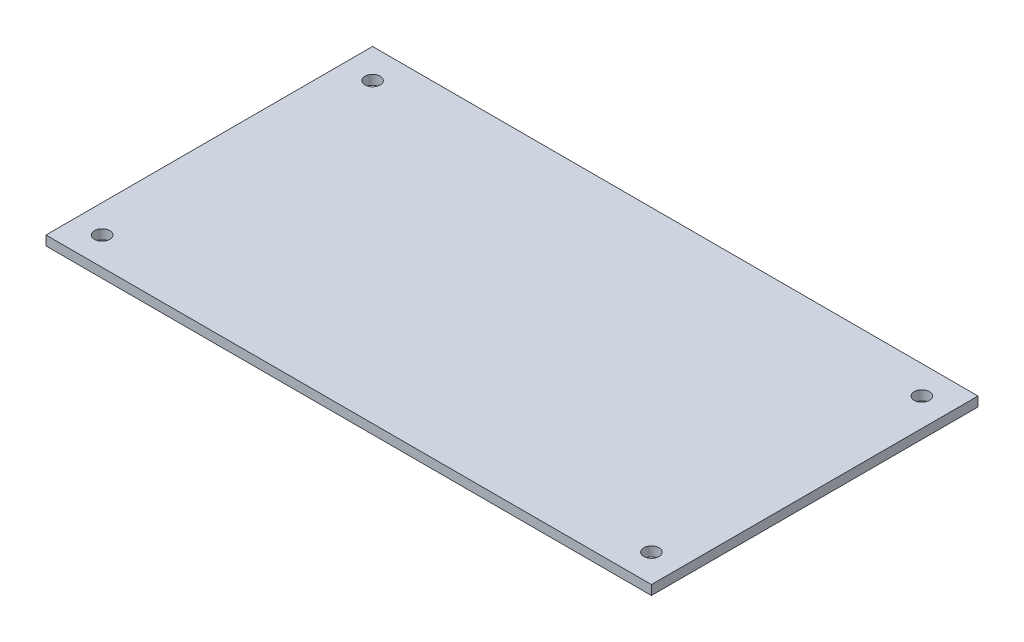
from build123d import *

# Parameters (mm, degrees)
SKETCH1_W           = 127
SKETCH1_H           = 68.5
BOSS_EXTRUDE1_DEPTH = 2
SKETCH2_R           = 1.6
CUT_EXTRUDE1_DEPTH  = 2


with BuildPart() as part:
    # Sketch1 → Boss-Extrude1 (new body)
    with BuildSketch(Plane(origin=(0, 0, 0), x_dir=(1, 0, 0), z_dir=(0, 1, 0))):
        with Locations((-36.776061776, -7.771235521)):
            Rectangle(SKETCH1_W, SKETCH1_H)
    extrude(amount=BOSS_EXTRUDE1_DEPTH)

    # Sketch2 → Cut-Extrude1 (cut)
    with BuildSketch(Plane(origin=(0, 2, 0), x_dir=(1, 0, 0), z_dir=(0, 1, 0))):
        with Locations(Location((-94.076061776, 20.278764479, 0), (0, 0, 270))):
            Circle(SKETCH2_R)
        with Locations(Location((-94.386061776, -36.131235521, 0), (0, 0, 270))):
            Circle(SKETCH2_R)
        with Locations(Location((20.833938224, -36.131235521, 0), (0, 0, 270))):
            Circle(SKETCH2_R)
        with Locations(Location((20.833938224, 20.588764479, 0), (0, 0, 270))):
            Circle(SKETCH2_R)
    extrude(amount=-CUT_EXTRUDE1_DEPTH, mode=Mode.SUBTRACT)


solid = part.part
